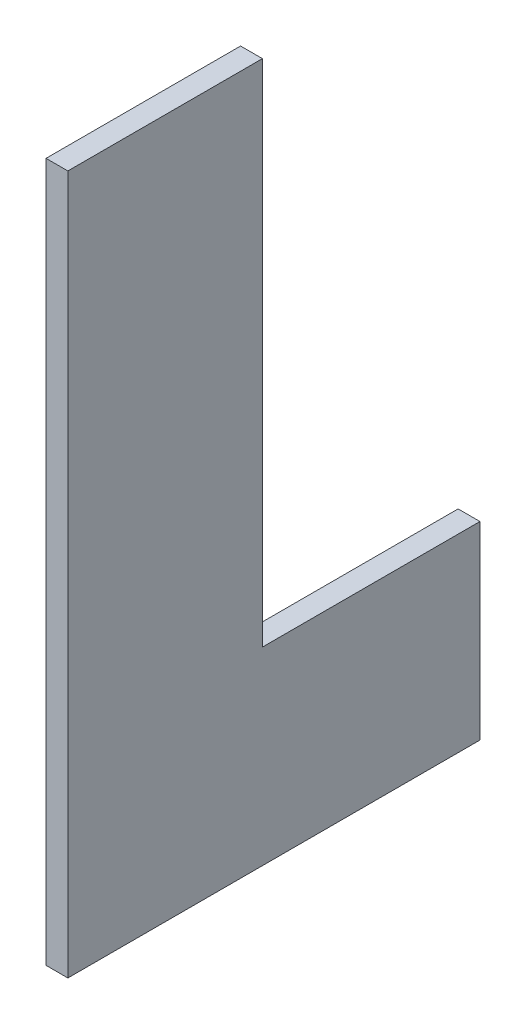
from build123d import *

# Parameters (mm, degrees)
BOSS_EXTRUDE1_DEPTH = 19.05


with BuildPart() as part:
    # Sketch1 → Boss-Extrude1 (new body)
    with BuildSketch(Plane(origin=(0, 0, 0), x_dir=(0, 0, -1), z_dir=(1, 0, 0))):
        Polygon((102.705829668, -525.352237324), (292.443829668, -525.352237324), (292.443829668, -360.252237324), (102.705829668, -360.252237324), (102.705829668, 84.247762676), (-66.966170332, 84.247762676), (-66.966170332, -525.352237324), align=None)
    extrude(amount=BOSS_EXTRUDE1_DEPTH)


solid = part.part
